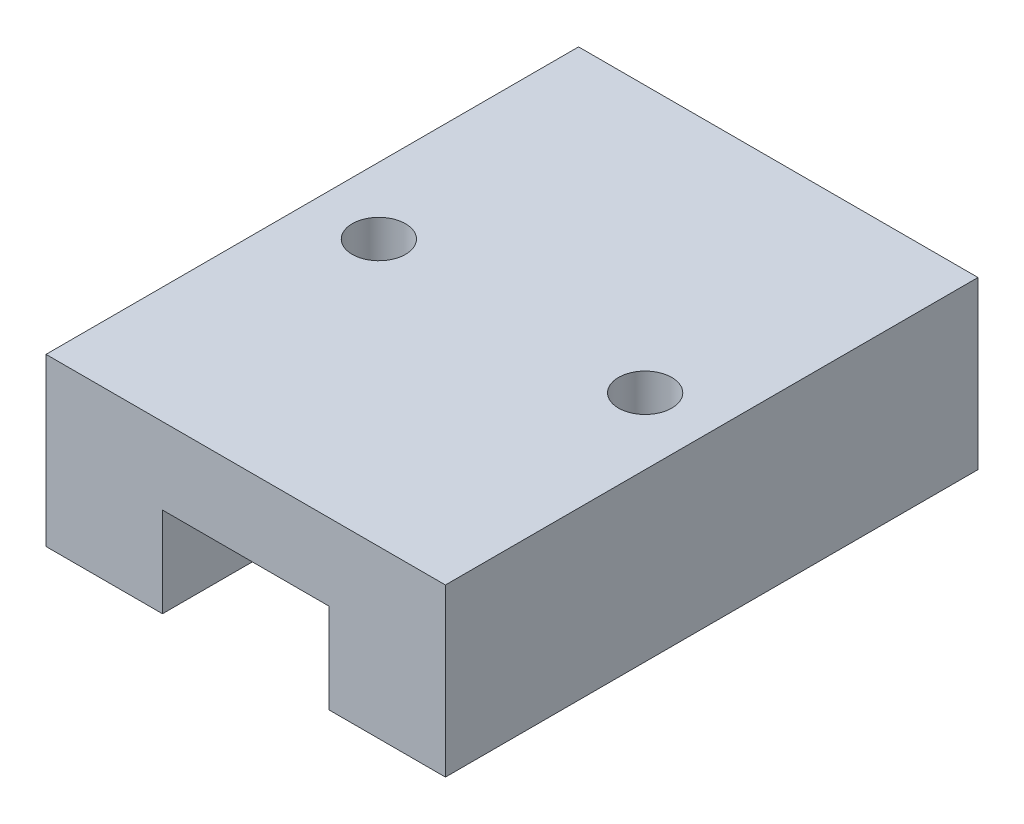
from build123d import *

# Parameters (mm, degrees)
EXTRUDE_1_DEPTH        = 8
HOLE_WIZARD_M2_1_D     = 1.6
HOLE_WIZARD_M2_1_DEPTH = 2.7
HOLE_WIZARD_M2_1_TIP   = 0.480688495


with BuildPart() as part:
    # 草图1 → 凸台-拉伸1 (new, symmetric)
    with BuildSketch(Plane.XY):
        Polygon((-6, 5), (6, 5), (6, 0), (2.5, 0), (2.5, 2.7), (-2.5, 2.7), (-2.5, 0), (-6, 0), align=None)
    extrude(amount=EXTRUDE_1_DEPTH, both=True)

    # M2 螺纹孔1
    with Locations(Plane(origin=(0, 5, 0), x_dir=(1, 0, 0), z_dir=(0, 1, 0))):
        with Locations((-4, 0), (4, 0)):
            Hole(HOLE_WIZARD_M2_1_D / 2, depth=HOLE_WIZARD_M2_1_DEPTH)
            with Locations((0, 0, -(HOLE_WIZARD_M2_1_DEPTH + HOLE_WIZARD_M2_1_TIP / 2))):  # 118° drill point
                Cone(0, HOLE_WIZARD_M2_1_D / 2, HOLE_WIZARD_M2_1_TIP, mode=Mode.SUBTRACT)


solid = part.part
